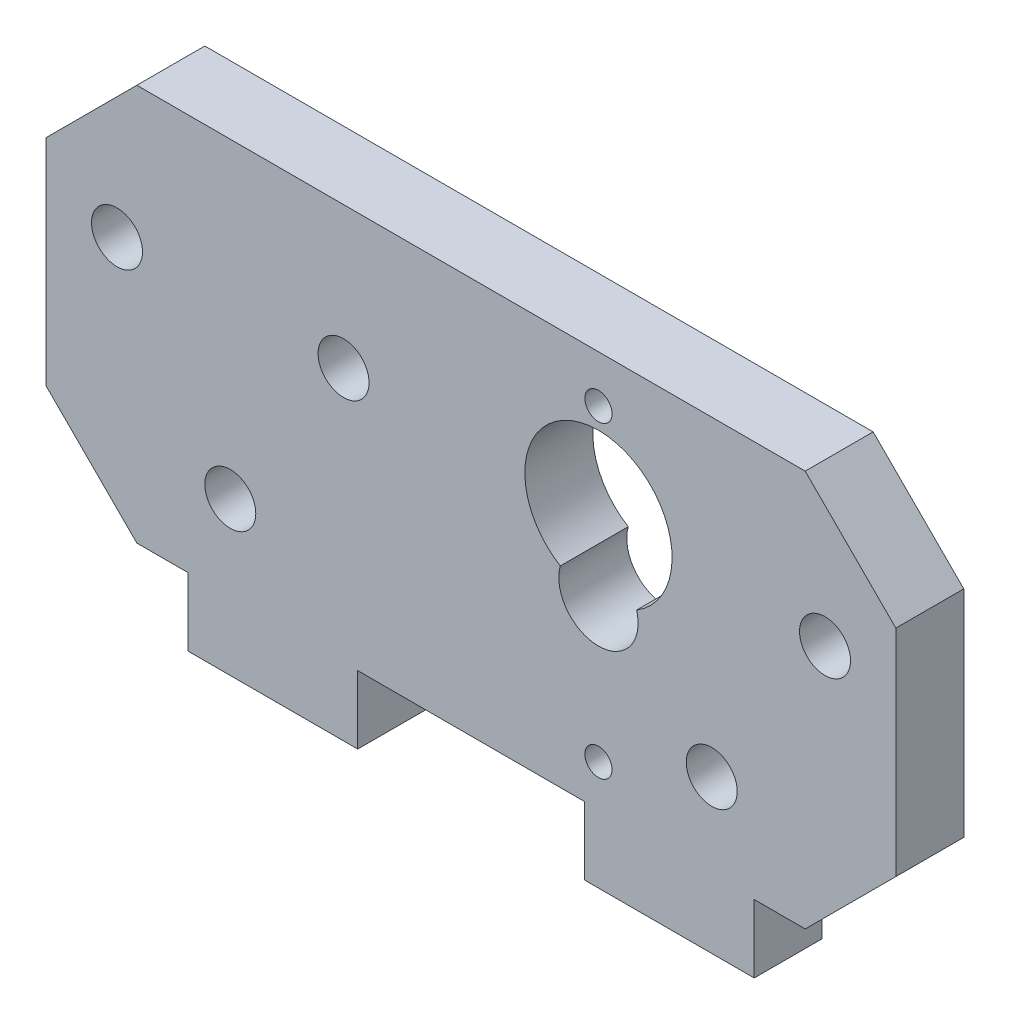
from build123d import *

# Parameters (mm, degrees)
CROQUIS1_W                   = 75
CROQUIS1_H                   = 35
CROQUIS1_R                   = 2.25
SALIENTE_EXTRUIR1_DEPTH      = 3
TALADRO_DE_MARGEN_PARA_M41_D = 4.5
TALADRO_DE_MARGEN_PARA_M21_D = 2.4
CROQUIS6_W                   = 15
CROQUIS6_H                   = 6
SALIENTE_EXTRUIR2_DEPTH      = 6
REDONDEO1_SIZE               = 8


with BuildPart() as part:
    # Croquis1 → Saliente-Extruir1 (new, symmetric)
    with BuildSketch(Plane.XY):
        Rectangle(CROQUIS1_W, CROQUIS1_H)
        with Locations((-11.25, 5)):
            Circle(CROQUIS1_R, mode=Mode.SUBTRACT)
        with BuildLine():
            ThreePointArc((14.62076493, -0.557692308), (11.25, 11.5), (7.87923507, -0.557692308))
            ThreePointArc((7.87923507, -0.557692308), (11.25, -5), (14.62076493, -0.557692308))
        make_face(mode=Mode.SUBTRACT)
    extrude(amount=SALIENTE_EXTRUIR1_DEPTH, both=True)

    # Taladro de margen para M41 (through all)
    with Locations(Plane.XY.offset(3)):
        with Locations((-31.25, 5), (31.25, 5), (21.25, -10), (-21.25, -10)):
            Hole(TALADRO_DE_MARGEN_PARA_M41_D / 2)

    # Taladro de margen para M21 (through all)
    with Locations(Plane.XY.offset(3)):
        with Locations((11.25, 13.35), (11.25, -13.85)):
            Hole(TALADRO_DE_MARGEN_PARA_M21_D / 2)

    # Croquis6 → Saliente-Extruir2 (add, through all)
    with BuildSketch(Plane.XY.offset(3)):
        with Locations((-17.5, -20.5)):
            Rectangle(CROQUIS6_W, CROQUIS6_H)
        with Locations((17.5, -20.5)):
            Rectangle(CROQUIS6_W, CROQUIS6_H)
    extrude(amount=-SALIENTE_EXTRUIR2_DEPTH)

    # Redondeo1
    redondeo1_edges = [part.edges().sort_by_distance(p)[0] for p in [
        (-37.5, 17.5, 0),
        (37.5, 17.5, 0),
        (37.5, -17.5, 0),
        (-37.5, -17.5, 0),
    ]]
    chamfer(redondeo1_edges, length=REDONDEO1_SIZE)


solid = part.part
